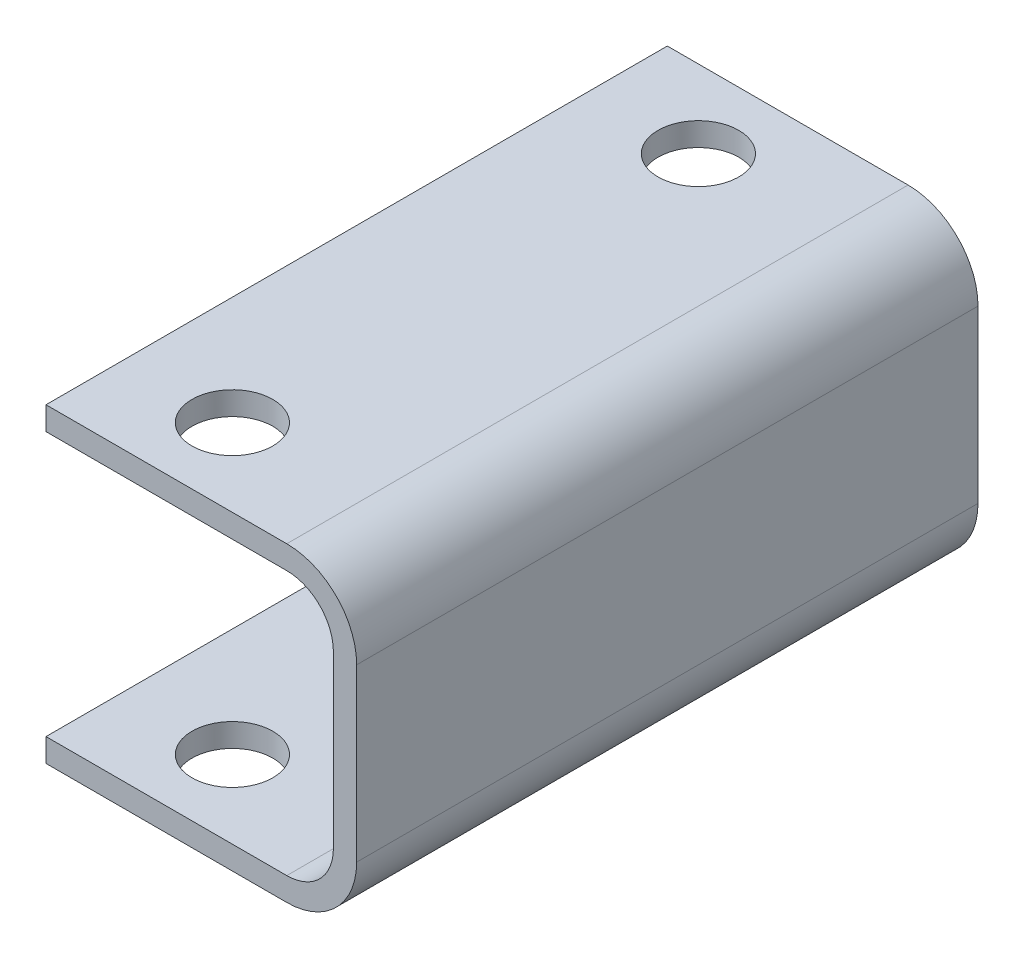
from build123d import *

# Parameters (mm, degrees)
AUFSATZ_LINEAR_AUSTRAGEN1_DEPTH = 40
SCHNITT_LINEAR_AUSTRAGEN1_REACH = 49.036
SKIZZE2_R                       = 2.6


with BuildPart() as part:
    # Skizze1 → Aufsatz-Linear austragen1 (new body)
    with BuildSketch(Plane(origin=(0, 0, 0), x_dir=(0, 1, 0), z_dir=(0, 0, 1))):
        with BuildLine():
            Line((5.5, -5.425677432), (-5.5, -5.425677432))
            ThreePointArc((-5.5, -5.425677432), (-8.681980515, -4.107657947), (-10, -0.925677432))
            Line((-10, -0.925677432), (-10, 14.574322568))
            Line((-10, 14.574322568), (-8.5, 14.574322568))
            Line((-8.5, 14.574322568), (-8.5, -0.925677432))
            ThreePointArc((-8.5, -0.925677432), (-7.621320344, -3.046997775), (-5.5, -3.925677432))
            Line((-5.5, -3.925677432), (5.5, -3.925677432))
            ThreePointArc((5.5, -3.925677432), (7.621320344, -3.046997775), (8.5, -0.925677432))
            Line((8.5, -0.925677432), (8.5, 14.574322568))
            Line((8.5, 14.574322568), (10, 14.574322568))
            Line((10, 14.574322568), (10, -0.925677432))
            ThreePointArc((10, -0.925677432), (8.681980515, -4.107657947), (5.5, -5.425677432))
        make_face()
    extrude(amount=AUFSATZ_LINEAR_AUSTRAGEN1_DEPTH)

    # Schnitt-Linear austragen1: up to this face of the body (flat: up to its plane)
    schnitt_linear_austragen1_end = Plane(part.part.faces().sort_by_distance((-6.824322568, 10, 20))[0])
    # Skizze2 → Schnitt-Linear austragen1 (cut, up to the picked face)
    with BuildSketch(Plane.XZ.offset(10), mode=Mode.PRIVATE) as schnitt_linear_austragen1_sk1:
        with Locations(Location((-7.574322568, 35, 0), (0, 0, 270))):
            Circle(SKIZZE2_R)
    schnitt_linear_austragen1_tool1 = split(extrude(schnitt_linear_austragen1_sk1.sketch, amount=-SCHNITT_LINEAR_AUSTRAGEN1_REACH, mode=Mode.PRIVATE), bisect_by=schnitt_linear_austragen1_end, keep=Keep.BOTH, mode=Mode.PRIVATE)
    # Skizze2 → Schnitt-Linear austragen1 (cut, up to the picked face)
    with BuildSketch(Plane.XZ.offset(10), mode=Mode.PRIVATE) as schnitt_linear_austragen1_sk2:
        with Locations(Location((-7.574322568, 5, 0), (0, 0, 270))):
            Circle(SKIZZE2_R)
    schnitt_linear_austragen1_tool2 = split(extrude(schnitt_linear_austragen1_sk2.sketch, amount=-SCHNITT_LINEAR_AUSTRAGEN1_REACH, mode=Mode.PRIVATE), bisect_by=schnitt_linear_austragen1_end, keep=Keep.BOTH, mode=Mode.PRIVATE)
    add(schnitt_linear_austragen1_tool1.solids().sort_by(Axis((-7.574323, -10, 35), (0, 1, 0)))[0], mode=Mode.SUBTRACT)
    add(schnitt_linear_austragen1_tool2.solids().sort_by(Axis((-7.574323, -10, 5), (0, 1, 0)))[0], mode=Mode.SUBTRACT)


solid = part.part
